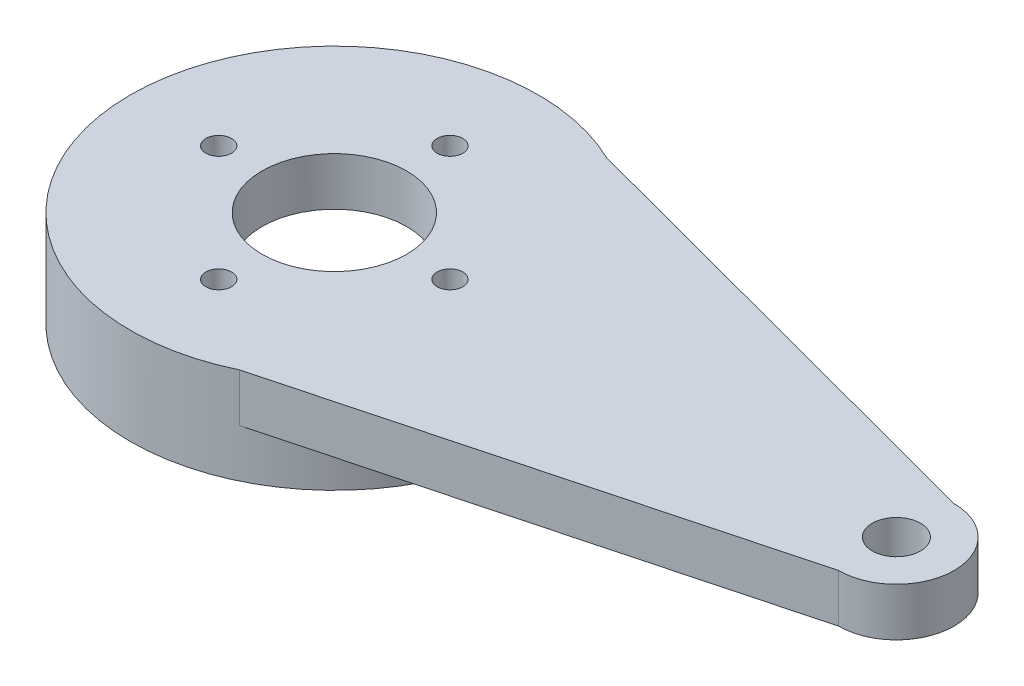
from build123d import *

# Parameters (mm, degrees)
SKETCH1_R           = 1.5
SKETCH1_R_2         = 0.8
BOSS_EXTRUDE1_DEPTH = 3
BOSS_EXTRUDE2_START = -3
SKETCH1_3_R         = 10.7
BOSS_EXTRUDE2_DEPTH = 3
SKETCH2_R           = 4.5
CUT_EXTRUDE1_DEPTH  = 10


with BuildPart() as part:
    # Sketch1 → Boss-Extrude1 (new body)
    with BuildSketch(Plane(origin=(0, 0, 0), x_dir=(1, 0, 0), z_dir=(0, 1, 0))):
        with BuildLine():
            Line((5.526066251, -11.434709956), (35, -3.6))
            ThreePointArc((35, -3.6), (38.6, 0), (35, 3.6))
            Line((35, 3.6), (5.526066251, 11.434709956))
            ThreePointArc((5.526066251, 11.434709956), (-12.7, 0), (5.526066251, -11.434709956))
        make_face()
        with Locations((35, 0)):
            Circle(SKETCH1_R, mode=Mode.SUBTRACT)
        with Locations((0, 7.2)):
            Circle(SKETCH1_R_2, mode=Mode.SUBTRACT)
        with Locations((0, -7.2)):
            Circle(SKETCH1_R_2, mode=Mode.SUBTRACT)
        with Locations((7.2, 0)):
            Circle(SKETCH1_R_2, mode=Mode.SUBTRACT)
        with Locations((-7.2, 0)):
            Circle(SKETCH1_R_2, mode=Mode.SUBTRACT)
        Circle(SKETCH1_R, mode=Mode.SUBTRACT)
    extrude(amount=BOSS_EXTRUDE1_DEPTH)

    # Sketch1<3> → Boss-Extrude2 (add)
    with BuildSketch(Plane(origin=(0, 0, 0), x_dir=(1, 0, 0), z_dir=(0, 1, 0)).offset(BOSS_EXTRUDE2_START)):
        with BuildLine():
            ThreePointArc((12.7, 0), (10.758044464, 6.749405848), (5.526066251, 11.434709956))
            ThreePointArc((5.526066251, 11.434709956), (-12.7, 0), (5.526066251, -11.434709956))
            ThreePointArc((5.526066251, -11.434709956), (10.758044464, -6.749405848), (12.7, 0))
        make_face()
        Circle(SKETCH1_3_R, mode=Mode.SUBTRACT)
    extrude(amount=BOSS_EXTRUDE2_DEPTH)

    # Sketch2 → Cut-Extrude1 (cut)
    with BuildSketch(Plane.XZ):
        Circle(SKETCH2_R)
    extrude(amount=-CUT_EXTRUDE1_DEPTH, mode=Mode.SUBTRACT)


solid = part.part
